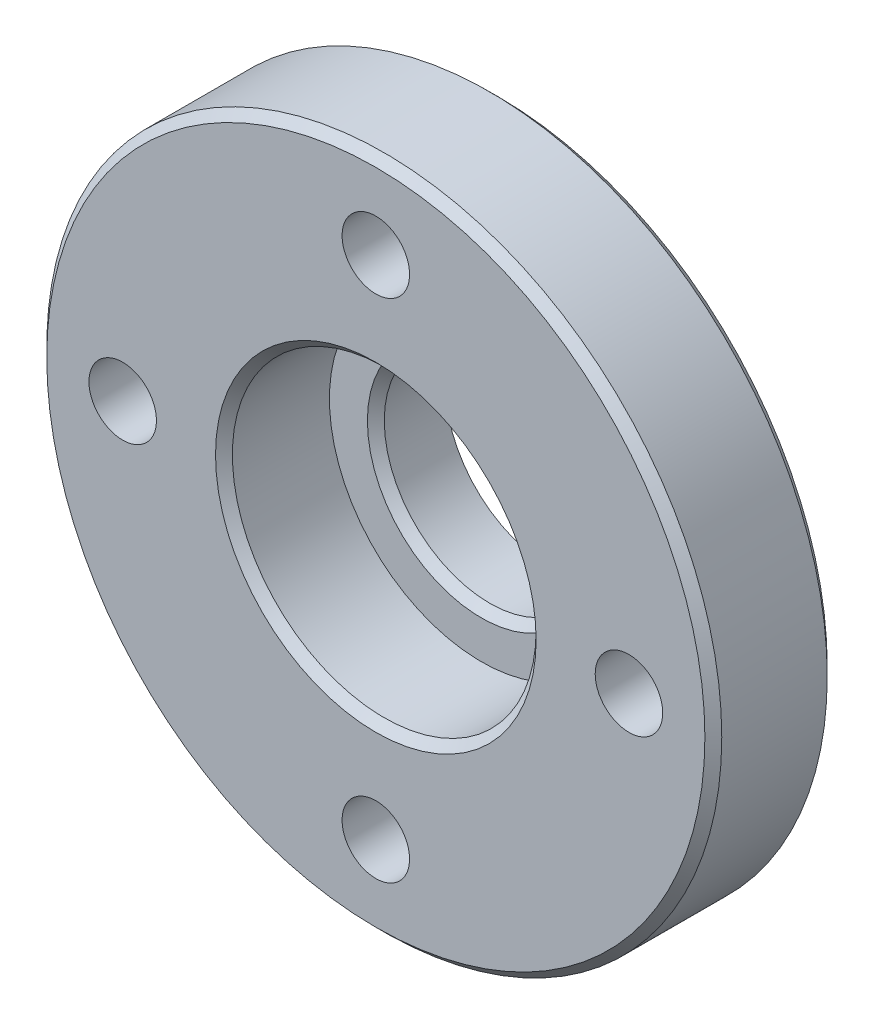
from build123d import *

# Parameters (mm, degrees)
SKETCH1_W                  = 8
SKETCH1_H                  = 2.9
SKETCH2_R                  = 3.25
BOSS_EXTRUDE1_DEPTH        = 1.25
F_1_6_1_6_DIAMETER_HOLE1_D = 1.6
HOLE1_D                    = 5
HOLE1_CBORE_D              = 7.2
HOLE1_CBORE_DEPTH          = 2.5
CHAMFER1_SIZE              = 0.2
FILLET1_R                  = 0.3


with BuildPart() as part:
    # Sketch1 → Revolve1 (revolve)
    with BuildSketch(Plane(origin=(0, 0, 0), x_dir=(1, 0, 0), z_dir=(0, 1, 0))):
        with Locations((4, -1.45)):
            Rectangle(SKETCH1_W, SKETCH1_H)
    revolve(axis=Axis((0, 0, 0), (0, 0, 1)))

    # Sketch2 → Boss-Extrude1 (add)
    with BuildSketch(Plane(origin=(0, 0, 0), x_dir=(-1, 0, 0), z_dir=(0, 0, -1))):
        Circle(SKETCH2_R)
    extrude(amount=BOSS_EXTRUDE1_DEPTH)

    # Ø1.6 (1.6) Diameter Hole1 (through all)
    with Locations(Plane(origin=(0, 0, 0), x_dir=(-1, 0, 0), z_dir=(0, 0, -1))):
        with Locations((0, 6), (6, 0), (0, -6), (-6, 0)):
            Hole(F_1_6_1_6_DIAMETER_HOLE1_D / 2)

    # Hole1 (through all)
    with Locations(Plane.XY.offset(2.9)):
        with Locations((0, 0)):
            CounterBoreHole(HOLE1_D / 2, HOLE1_CBORE_D / 2, HOLE1_CBORE_DEPTH)

    # Chamfer1
    chamfer1_edges = [part.edges().sort_by_distance(p)[0] for p in [
        (-3.6, 0, 2.9),
        (-8, 0, 2.9),
        (2.5, 0, 0.4),
        (-8, 0, 0),
    ]]
    chamfer(chamfer1_edges, length=CHAMFER1_SIZE)

    # Fillet1
    fillet1_edges = [part.edges().sort_by_distance(p)[0] for p in [
        (3.25, 0, 0),
    ]]
    fillet(fillet1_edges, radius=FILLET1_R)


solid = part.part
